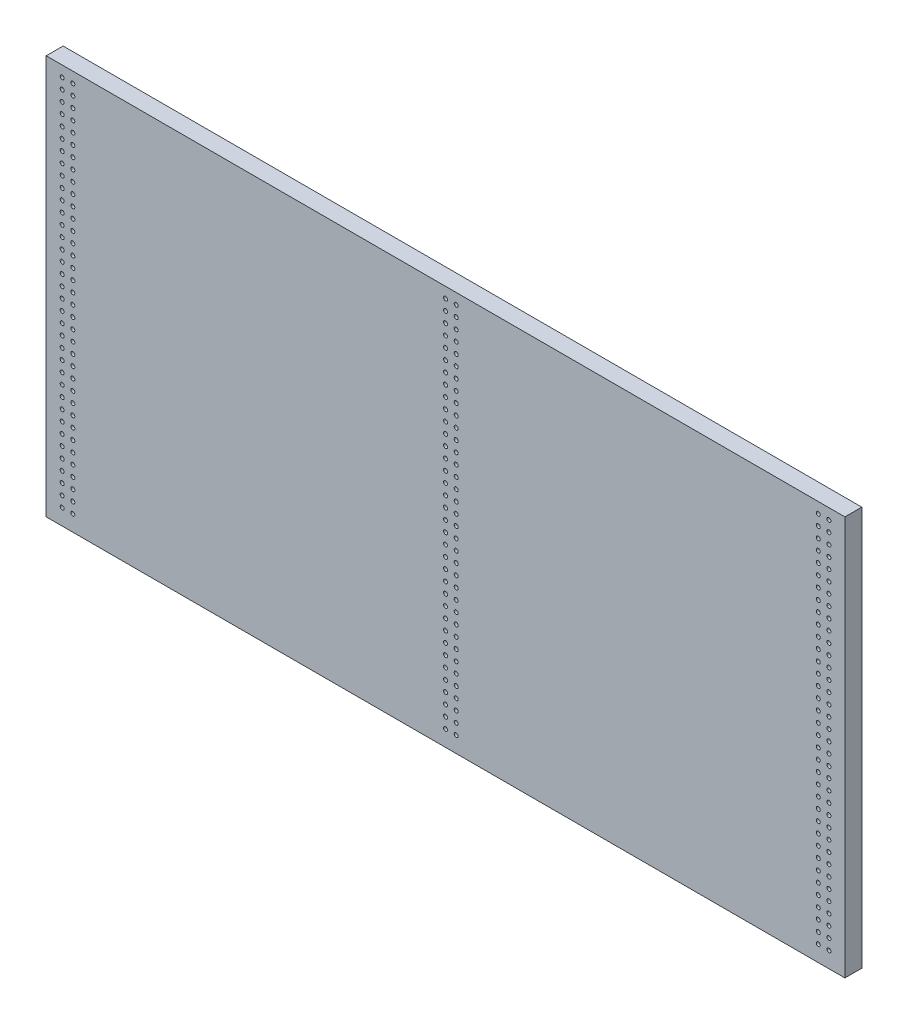
from build123d import *

# Parameters (mm, degrees)
SKETCH1_W           = 300
SKETCH1_H           = 150
SKETCH1_R           = 0.75
BOSS_EXTRUDE1_DEPTH = 6.35


with BuildPart() as part:
    # Sketch1 → Boss-Extrude1 (new body)
    with BuildSketch(Plane.XY):
        with Locations((150, 75)):
            Rectangle(SKETCH1_W, SKETCH1_H)
        with Locations((6, 146)):
            Circle(SKETCH1_R, mode=Mode.SUBTRACT)
        with Locations((10, 146)):
            Circle(SKETCH1_R, mode=Mode.SUBTRACT)
        with Locations((6, 142)):
            Circle(SKETCH1_R, mode=Mode.SUBTRACT)
        with Locations((10, 142)):
            Circle(SKETCH1_R, mode=Mode.SUBTRACT)
        with Locations((6, 138)):
            Circle(SKETCH1_R, mode=Mode.SUBTRACT)
        with Locations((10, 138)):
            Circle(SKETCH1_R, mode=Mode.SUBTRACT)
        with Locations((6, 134)):
            Circle(SKETCH1_R, mode=Mode.SUBTRACT)
        with Locations((10, 134)):
            Circle(SKETCH1_R, mode=Mode.SUBTRACT)
        with Locations((6, 130)):
            Circle(SKETCH1_R, mode=Mode.SUBTRACT)
        with Locations((10, 130)):
            Circle(SKETCH1_R, mode=Mode.SUBTRACT)
        with Locations((6, 126)):
            Circle(SKETCH1_R, mode=Mode.SUBTRACT)
        with Locations((10, 126)):
            Circle(SKETCH1_R, mode=Mode.SUBTRACT)
        with Locations((6, 122)):
            Circle(SKETCH1_R, mode=Mode.SUBTRACT)
        with Locations((10, 122)):
            Circle(SKETCH1_R, mode=Mode.SUBTRACT)
        with Locations((6, 118)):
            Circle(SKETCH1_R, mode=Mode.SUBTRACT)
        with Locations((10, 118)):
            Circle(SKETCH1_R, mode=Mode.SUBTRACT)
        with Locations((6, 114)):
            Circle(SKETCH1_R, mode=Mode.SUBTRACT)
        with Locations((10, 114)):
            Circle(SKETCH1_R, mode=Mode.SUBTRACT)
        with Locations((6, 110)):
            Circle(SKETCH1_R, mode=Mode.SUBTRACT)
        with Locations((10, 110)):
            Circle(SKETCH1_R, mode=Mode.SUBTRACT)
        with Locations((6, 106)):
            Circle(SKETCH1_R, mode=Mode.SUBTRACT)
        with Locations((10, 106)):
            Circle(SKETCH1_R, mode=Mode.SUBTRACT)
        with Locations((6, 102)):
            Circle(SKETCH1_R, mode=Mode.SUBTRACT)
        with Locations((10, 102)):
            Circle(SKETCH1_R, mode=Mode.SUBTRACT)
        with Locations((6, 98)):
            Circle(SKETCH1_R, mode=Mode.SUBTRACT)
        with Locations((10, 98)):
            Circle(SKETCH1_R, mode=Mode.SUBTRACT)
        with Locations((6, 94)):
            Circle(SKETCH1_R, mode=Mode.SUBTRACT)
        with Locations((10, 94)):
            Circle(SKETCH1_R, mode=Mode.SUBTRACT)
        with Locations((6, 90)):
            Circle(SKETCH1_R, mode=Mode.SUBTRACT)
        with Locations((10, 90)):
            Circle(SKETCH1_R, mode=Mode.SUBTRACT)
        with Locations((6, 86)):
            Circle(SKETCH1_R, mode=Mode.SUBTRACT)
        with Locations((10, 86)):
            Circle(SKETCH1_R, mode=Mode.SUBTRACT)
        with Locations((6, 82)):
            Circle(SKETCH1_R, mode=Mode.SUBTRACT)
        with Locations((10, 82)):
            Circle(SKETCH1_R, mode=Mode.SUBTRACT)
        with Locations((6, 78)):
            Circle(SKETCH1_R, mode=Mode.SUBTRACT)
        with Locations((10, 78)):
            Circle(SKETCH1_R, mode=Mode.SUBTRACT)
        with Locations((6, 74)):
            Circle(SKETCH1_R, mode=Mode.SUBTRACT)
        with Locations((10, 74)):
            Circle(SKETCH1_R, mode=Mode.SUBTRACT)
        with Locations((6, 70)):
            Circle(SKETCH1_R, mode=Mode.SUBTRACT)
        with Locations((10, 70)):
            Circle(SKETCH1_R, mode=Mode.SUBTRACT)
        with Locations((6, 66)):
            Circle(SKETCH1_R, mode=Mode.SUBTRACT)
        with Locations((10, 66)):
            Circle(SKETCH1_R, mode=Mode.SUBTRACT)
        with Locations((6, 62)):
            Circle(SKETCH1_R, mode=Mode.SUBTRACT)
        with Locations((10, 62)):
            Circle(SKETCH1_R, mode=Mode.SUBTRACT)
        with Locations((6, 58)):
            Circle(SKETCH1_R, mode=Mode.SUBTRACT)
        with Locations((10, 58)):
            Circle(SKETCH1_R, mode=Mode.SUBTRACT)
        with Locations((6, 54)):
            Circle(SKETCH1_R, mode=Mode.SUBTRACT)
        with Locations((10, 54)):
            Circle(SKETCH1_R, mode=Mode.SUBTRACT)
        with Locations((6, 50)):
            Circle(SKETCH1_R, mode=Mode.SUBTRACT)
        with Locations((10, 50)):
            Circle(SKETCH1_R, mode=Mode.SUBTRACT)
        with Locations((6, 46)):
            Circle(SKETCH1_R, mode=Mode.SUBTRACT)
        with Locations((10, 46)):
            Circle(SKETCH1_R, mode=Mode.SUBTRACT)
        with Locations((6, 42)):
            Circle(SKETCH1_R, mode=Mode.SUBTRACT)
        with Locations((10, 42)):
            Circle(SKETCH1_R, mode=Mode.SUBTRACT)
        with Locations((6, 38)):
            Circle(SKETCH1_R, mode=Mode.SUBTRACT)
        with Locations((10, 38)):
            Circle(SKETCH1_R, mode=Mode.SUBTRACT)
        with Locations((6, 34)):
            Circle(SKETCH1_R, mode=Mode.SUBTRACT)
        with Locations((10, 34)):
            Circle(SKETCH1_R, mode=Mode.SUBTRACT)
        with Locations((6, 30)):
            Circle(SKETCH1_R, mode=Mode.SUBTRACT)
        with Locations((10, 30)):
            Circle(SKETCH1_R, mode=Mode.SUBTRACT)
        with Locations((6, 26)):
            Circle(SKETCH1_R, mode=Mode.SUBTRACT)
        with Locations((10, 26)):
            Circle(SKETCH1_R, mode=Mode.SUBTRACT)
        with Locations((6, 22)):
            Circle(SKETCH1_R, mode=Mode.SUBTRACT)
        with Locations((10, 22)):
            Circle(SKETCH1_R, mode=Mode.SUBTRACT)
        with Locations((6, 18)):
            Circle(SKETCH1_R, mode=Mode.SUBTRACT)
        with Locations((10, 18)):
            Circle(SKETCH1_R, mode=Mode.SUBTRACT)
        with Locations((6, 14)):
            Circle(SKETCH1_R, mode=Mode.SUBTRACT)
        with Locations((10, 14)):
            Circle(SKETCH1_R, mode=Mode.SUBTRACT)
        with Locations((6, 10)):
            Circle(SKETCH1_R, mode=Mode.SUBTRACT)
        with Locations((10, 10)):
            Circle(SKETCH1_R, mode=Mode.SUBTRACT)
        with Locations((6, 6)):
            Circle(SKETCH1_R, mode=Mode.SUBTRACT)
        with Locations((10, 6)):
            Circle(SKETCH1_R, mode=Mode.SUBTRACT)
        with Locations(Location((290, 6, 0), (0, 0, 180))):
            Circle(SKETCH1_R, mode=Mode.SUBTRACT)
        with Locations(Location((294, 6, 0), (0, 0, 180))):
            Circle(SKETCH1_R, mode=Mode.SUBTRACT)
        with Locations(Location((290, 10, 0), (0, 0, 180))):
            Circle(SKETCH1_R, mode=Mode.SUBTRACT)
        with Locations(Location((294, 10, 0), (0, 0, 180))):
            Circle(SKETCH1_R, mode=Mode.SUBTRACT)
        with Locations(Location((290, 14, 0), (0, 0, 180))):
            Circle(SKETCH1_R, mode=Mode.SUBTRACT)
        with Locations(Location((294, 14, 0), (0, 0, 180))):
            Circle(SKETCH1_R, mode=Mode.SUBTRACT)
        with Locations(Location((290, 18, 0), (0, 0, 180))):
            Circle(SKETCH1_R, mode=Mode.SUBTRACT)
        with Locations(Location((294, 18, 0), (0, 0, 180))):
            Circle(SKETCH1_R, mode=Mode.SUBTRACT)
        with Locations(Location((290, 22, 0), (0, 0, 180))):
            Circle(SKETCH1_R, mode=Mode.SUBTRACT)
        with Locations(Location((294, 22, 0), (0, 0, 180))):
            Circle(SKETCH1_R, mode=Mode.SUBTRACT)
        with Locations(Location((290, 26, 0), (0, 0, 180))):
            Circle(SKETCH1_R, mode=Mode.SUBTRACT)
        with Locations(Location((294, 26, 0), (0, 0, 180))):
            Circle(SKETCH1_R, mode=Mode.SUBTRACT)
        with Locations(Location((290, 30, 0), (0, 0, 180))):
            Circle(SKETCH1_R, mode=Mode.SUBTRACT)
        with Locations(Location((294, 30, 0), (0, 0, 180))):
            Circle(SKETCH1_R, mode=Mode.SUBTRACT)
        with Locations(Location((290, 34, 0), (0, 0, 180))):
            Circle(SKETCH1_R, mode=Mode.SUBTRACT)
        with Locations(Location((294, 34, 0), (0, 0, 180))):
            Circle(SKETCH1_R, mode=Mode.SUBTRACT)
        with Locations(Location((290, 38, 0), (0, 0, 180))):
            Circle(SKETCH1_R, mode=Mode.SUBTRACT)
        with Locations(Location((294, 38, 0), (0, 0, 180))):
            Circle(SKETCH1_R, mode=Mode.SUBTRACT)
        with Locations(Location((290, 42, 0), (0, 0, 180))):
            Circle(SKETCH1_R, mode=Mode.SUBTRACT)
        with Locations(Location((294, 42, 0), (0, 0, 180))):
            Circle(SKETCH1_R, mode=Mode.SUBTRACT)
        with Locations((150, 146)):
            Circle(SKETCH1_R, mode=Mode.SUBTRACT)
        with Locations((154, 146)):
            Circle(SKETCH1_R, mode=Mode.SUBTRACT)
        with Locations((150, 142)):
            Circle(SKETCH1_R, mode=Mode.SUBTRACT)
        with Locations((154, 142)):
            Circle(SKETCH1_R, mode=Mode.SUBTRACT)
        with Locations((150, 138)):
            Circle(SKETCH1_R, mode=Mode.SUBTRACT)
        with Locations((154, 138)):
            Circle(SKETCH1_R, mode=Mode.SUBTRACT)
        with Locations((150, 134)):
            Circle(SKETCH1_R, mode=Mode.SUBTRACT)
        with Locations((154, 134)):
            Circle(SKETCH1_R, mode=Mode.SUBTRACT)
        with Locations((150, 130)):
            Circle(SKETCH1_R, mode=Mode.SUBTRACT)
        with Locations((154, 130)):
            Circle(SKETCH1_R, mode=Mode.SUBTRACT)
        with Locations((150, 126)):
            Circle(SKETCH1_R, mode=Mode.SUBTRACT)
        with Locations((154, 126)):
            Circle(SKETCH1_R, mode=Mode.SUBTRACT)
        with Locations((150, 122)):
            Circle(SKETCH1_R, mode=Mode.SUBTRACT)
        with Locations((154, 122)):
            Circle(SKETCH1_R, mode=Mode.SUBTRACT)
        with Locations((150, 118)):
            Circle(SKETCH1_R, mode=Mode.SUBTRACT)
        with Locations((154, 118)):
            Circle(SKETCH1_R, mode=Mode.SUBTRACT)
        with Locations((150, 114)):
            Circle(SKETCH1_R, mode=Mode.SUBTRACT)
        with Locations((154, 114)):
            Circle(SKETCH1_R, mode=Mode.SUBTRACT)
        with Locations((150, 110)):
            Circle(SKETCH1_R, mode=Mode.SUBTRACT)
        with Locations((154, 110)):
            Circle(SKETCH1_R, mode=Mode.SUBTRACT)
        with Locations((150, 106)):
            Circle(SKETCH1_R, mode=Mode.SUBTRACT)
        with Locations((154, 106)):
            Circle(SKETCH1_R, mode=Mode.SUBTRACT)
        with Locations((150, 102)):
            Circle(SKETCH1_R, mode=Mode.SUBTRACT)
        with Locations((154, 102)):
            Circle(SKETCH1_R, mode=Mode.SUBTRACT)
        with Locations((150, 98)):
            Circle(SKETCH1_R, mode=Mode.SUBTRACT)
        with Locations((154, 98)):
            Circle(SKETCH1_R, mode=Mode.SUBTRACT)
        with Locations((150, 94)):
            Circle(SKETCH1_R, mode=Mode.SUBTRACT)
        with Locations((154, 94)):
            Circle(SKETCH1_R, mode=Mode.SUBTRACT)
        with Locations((150, 90)):
            Circle(SKETCH1_R, mode=Mode.SUBTRACT)
        with Locations((154, 90)):
            Circle(SKETCH1_R, mode=Mode.SUBTRACT)
        with Locations((150, 86)):
            Circle(SKETCH1_R, mode=Mode.SUBTRACT)
        with Locations((154, 86)):
            Circle(SKETCH1_R, mode=Mode.SUBTRACT)
        with Locations((150, 82)):
            Circle(SKETCH1_R, mode=Mode.SUBTRACT)
        with Locations((154, 82)):
            Circle(SKETCH1_R, mode=Mode.SUBTRACT)
        with Locations((150, 78)):
            Circle(SKETCH1_R, mode=Mode.SUBTRACT)
        with Locations((154, 78)):
            Circle(SKETCH1_R, mode=Mode.SUBTRACT)
        with Locations((150, 74)):
            Circle(SKETCH1_R, mode=Mode.SUBTRACT)
        with Locations((154, 74)):
            Circle(SKETCH1_R, mode=Mode.SUBTRACT)
        with Locations((150, 70)):
            Circle(SKETCH1_R, mode=Mode.SUBTRACT)
        with Locations((154, 70)):
            Circle(SKETCH1_R, mode=Mode.SUBTRACT)
        with Locations((150, 66)):
            Circle(SKETCH1_R, mode=Mode.SUBTRACT)
        with Locations((154, 66)):
            Circle(SKETCH1_R, mode=Mode.SUBTRACT)
        with Locations((150, 62)):
            Circle(SKETCH1_R, mode=Mode.SUBTRACT)
        with Locations((154, 62)):
            Circle(SKETCH1_R, mode=Mode.SUBTRACT)
        with Locations((150, 58)):
            Circle(SKETCH1_R, mode=Mode.SUBTRACT)
        with Locations((154, 58)):
            Circle(SKETCH1_R, mode=Mode.SUBTRACT)
        with Locations((150, 54)):
            Circle(SKETCH1_R, mode=Mode.SUBTRACT)
        with Locations((154, 54)):
            Circle(SKETCH1_R, mode=Mode.SUBTRACT)
        with Locations((150, 50)):
            Circle(SKETCH1_R, mode=Mode.SUBTRACT)
        with Locations((154, 50)):
            Circle(SKETCH1_R, mode=Mode.SUBTRACT)
        with Locations((150, 46)):
            Circle(SKETCH1_R, mode=Mode.SUBTRACT)
        with Locations((154, 46)):
            Circle(SKETCH1_R, mode=Mode.SUBTRACT)
        with Locations((150, 42)):
            Circle(SKETCH1_R, mode=Mode.SUBTRACT)
        with Locations((154, 42)):
            Circle(SKETCH1_R, mode=Mode.SUBTRACT)
        with Locations((150, 38)):
            Circle(SKETCH1_R, mode=Mode.SUBTRACT)
        with Locations((154, 38)):
            Circle(SKETCH1_R, mode=Mode.SUBTRACT)
        with Locations((150, 34)):
            Circle(SKETCH1_R, mode=Mode.SUBTRACT)
        with Locations((154, 34)):
            Circle(SKETCH1_R, mode=Mode.SUBTRACT)
        with Locations(Location((290, 46, 0), (0, 0, 180))):
            Circle(SKETCH1_R, mode=Mode.SUBTRACT)
        with Locations(Location((294, 46, 0), (0, 0, 180))):
            Circle(SKETCH1_R, mode=Mode.SUBTRACT)
        with Locations(Location((290, 50, 0), (0, 0, 180))):
            Circle(SKETCH1_R, mode=Mode.SUBTRACT)
        with Locations(Location((294, 50, 0), (0, 0, 180))):
            Circle(SKETCH1_R, mode=Mode.SUBTRACT)
        with Locations(Location((290, 54, 0), (0, 0, 180))):
            Circle(SKETCH1_R, mode=Mode.SUBTRACT)
        with Locations(Location((294, 54, 0), (0, 0, 180))):
            Circle(SKETCH1_R, mode=Mode.SUBTRACT)
        with Locations(Location((290, 58, 0), (0, 0, 180))):
            Circle(SKETCH1_R, mode=Mode.SUBTRACT)
        with Locations(Location((294, 58, 0), (0, 0, 180))):
            Circle(SKETCH1_R, mode=Mode.SUBTRACT)
        with Locations(Location((290, 62, 0), (0, 0, 180))):
            Circle(SKETCH1_R, mode=Mode.SUBTRACT)
        with Locations(Location((294, 62, 0), (0, 0, 180))):
            Circle(SKETCH1_R, mode=Mode.SUBTRACT)
        with Locations(Location((290, 66, 0), (0, 0, 180))):
            Circle(SKETCH1_R, mode=Mode.SUBTRACT)
        with Locations(Location((294, 66, 0), (0, 0, 180))):
            Circle(SKETCH1_R, mode=Mode.SUBTRACT)
        with Locations(Location((290, 70, 0), (0, 0, 180))):
            Circle(SKETCH1_R, mode=Mode.SUBTRACT)
        with Locations(Location((294, 70, 0), (0, 0, 180))):
            Circle(SKETCH1_R, mode=Mode.SUBTRACT)
        with Locations(Location((290, 74, 0), (0, 0, 180))):
            Circle(SKETCH1_R, mode=Mode.SUBTRACT)
        with Locations(Location((294, 74, 0), (0, 0, 180))):
            Circle(SKETCH1_R, mode=Mode.SUBTRACT)
        with Locations(Location((290, 78, 0), (0, 0, 180))):
            Circle(SKETCH1_R, mode=Mode.SUBTRACT)
        with Locations(Location((294, 78, 0), (0, 0, 180))):
            Circle(SKETCH1_R, mode=Mode.SUBTRACT)
        with Locations(Location((290, 82, 0), (0, 0, 180))):
            Circle(SKETCH1_R, mode=Mode.SUBTRACT)
        with Locations(Location((294, 82, 0), (0, 0, 180))):
            Circle(SKETCH1_R, mode=Mode.SUBTRACT)
        with Locations(Location((290, 86, 0), (0, 0, 180))):
            Circle(SKETCH1_R, mode=Mode.SUBTRACT)
        with Locations(Location((294, 86, 0), (0, 0, 180))):
            Circle(SKETCH1_R, mode=Mode.SUBTRACT)
        with Locations(Location((290, 90, 0), (0, 0, 180))):
            Circle(SKETCH1_R, mode=Mode.SUBTRACT)
        with Locations(Location((294, 90, 0), (0, 0, 180))):
            Circle(SKETCH1_R, mode=Mode.SUBTRACT)
        with Locations(Location((290, 94, 0), (0, 0, 180))):
            Circle(SKETCH1_R, mode=Mode.SUBTRACT)
        with Locations(Location((294, 94, 0), (0, 0, 180))):
            Circle(SKETCH1_R, mode=Mode.SUBTRACT)
        with Locations(Location((290, 98, 0), (0, 0, 180))):
            Circle(SKETCH1_R, mode=Mode.SUBTRACT)
        with Locations(Location((294, 98, 0), (0, 0, 180))):
            Circle(SKETCH1_R, mode=Mode.SUBTRACT)
        with Locations(Location((290, 102, 0), (0, 0, 180))):
            Circle(SKETCH1_R, mode=Mode.SUBTRACT)
        with Locations(Location((294, 102, 0), (0, 0, 180))):
            Circle(SKETCH1_R, mode=Mode.SUBTRACT)
        with Locations(Location((290, 106, 0), (0, 0, 180))):
            Circle(SKETCH1_R, mode=Mode.SUBTRACT)
        with Locations(Location((294, 106, 0), (0, 0, 180))):
            Circle(SKETCH1_R, mode=Mode.SUBTRACT)
        with Locations(Location((290, 110, 0), (0, 0, 180))):
            Circle(SKETCH1_R, mode=Mode.SUBTRACT)
        with Locations(Location((294, 110, 0), (0, 0, 180))):
            Circle(SKETCH1_R, mode=Mode.SUBTRACT)
        with Locations(Location((290, 114, 0), (0, 0, 180))):
            Circle(SKETCH1_R, mode=Mode.SUBTRACT)
        with Locations(Location((294, 114, 0), (0, 0, 180))):
            Circle(SKETCH1_R, mode=Mode.SUBTRACT)
        with Locations(Location((290, 118, 0), (0, 0, 180))):
            Circle(SKETCH1_R, mode=Mode.SUBTRACT)
        with Locations(Location((294, 118, 0), (0, 0, 180))):
            Circle(SKETCH1_R, mode=Mode.SUBTRACT)
        with Locations(Location((290, 122, 0), (0, 0, 180))):
            Circle(SKETCH1_R, mode=Mode.SUBTRACT)
        with Locations(Location((294, 122, 0), (0, 0, 180))):
            Circle(SKETCH1_R, mode=Mode.SUBTRACT)
        with Locations(Location((290, 126, 0), (0, 0, 180))):
            Circle(SKETCH1_R, mode=Mode.SUBTRACT)
        with Locations(Location((294, 126, 0), (0, 0, 180))):
            Circle(SKETCH1_R, mode=Mode.SUBTRACT)
        with Locations(Location((290, 130, 0), (0, 0, 180))):
            Circle(SKETCH1_R, mode=Mode.SUBTRACT)
        with Locations(Location((294, 130, 0), (0, 0, 180))):
            Circle(SKETCH1_R, mode=Mode.SUBTRACT)
        with Locations(Location((290, 134, 0), (0, 0, 180))):
            Circle(SKETCH1_R, mode=Mode.SUBTRACT)
        with Locations(Location((294, 134, 0), (0, 0, 180))):
            Circle(SKETCH1_R, mode=Mode.SUBTRACT)
        with Locations(Location((290, 138, 0), (0, 0, 180))):
            Circle(SKETCH1_R, mode=Mode.SUBTRACT)
        with Locations(Location((294, 138, 0), (0, 0, 180))):
            Circle(SKETCH1_R, mode=Mode.SUBTRACT)
        with Locations(Location((290, 142, 0), (0, 0, 180))):
            Circle(SKETCH1_R, mode=Mode.SUBTRACT)
        with Locations(Location((294, 142, 0), (0, 0, 180))):
            Circle(SKETCH1_R, mode=Mode.SUBTRACT)
        with Locations(Location((290, 146, 0), (0, 0, 180))):
            Circle(SKETCH1_R, mode=Mode.SUBTRACT)
        with Locations(Location((294, 146, 0), (0, 0, 180))):
            Circle(SKETCH1_R, mode=Mode.SUBTRACT)
        with Locations((150, 30)):
            Circle(SKETCH1_R, mode=Mode.SUBTRACT)
        with Locations((154, 30)):
            Circle(SKETCH1_R, mode=Mode.SUBTRACT)
        with Locations((150, 26)):
            Circle(SKETCH1_R, mode=Mode.SUBTRACT)
        with Locations((154, 26)):
            Circle(SKETCH1_R, mode=Mode.SUBTRACT)
        with Locations((150, 22)):
            Circle(SKETCH1_R, mode=Mode.SUBTRACT)
        with Locations((154, 22)):
            Circle(SKETCH1_R, mode=Mode.SUBTRACT)
        with Locations((150, 18)):
            Circle(SKETCH1_R, mode=Mode.SUBTRACT)
        with Locations((154, 18)):
            Circle(SKETCH1_R, mode=Mode.SUBTRACT)
        with Locations((150, 14)):
            Circle(SKETCH1_R, mode=Mode.SUBTRACT)
        with Locations((154, 14)):
            Circle(SKETCH1_R, mode=Mode.SUBTRACT)
        with Locations((150, 10)):
            Circle(SKETCH1_R, mode=Mode.SUBTRACT)
        with Locations((154, 10)):
            Circle(SKETCH1_R, mode=Mode.SUBTRACT)
        with Locations((150, 6)):
            Circle(SKETCH1_R, mode=Mode.SUBTRACT)
        with Locations((154, 6)):
            Circle(SKETCH1_R, mode=Mode.SUBTRACT)
    extrude(amount=BOSS_EXTRUDE1_DEPTH)


solid = part.part
